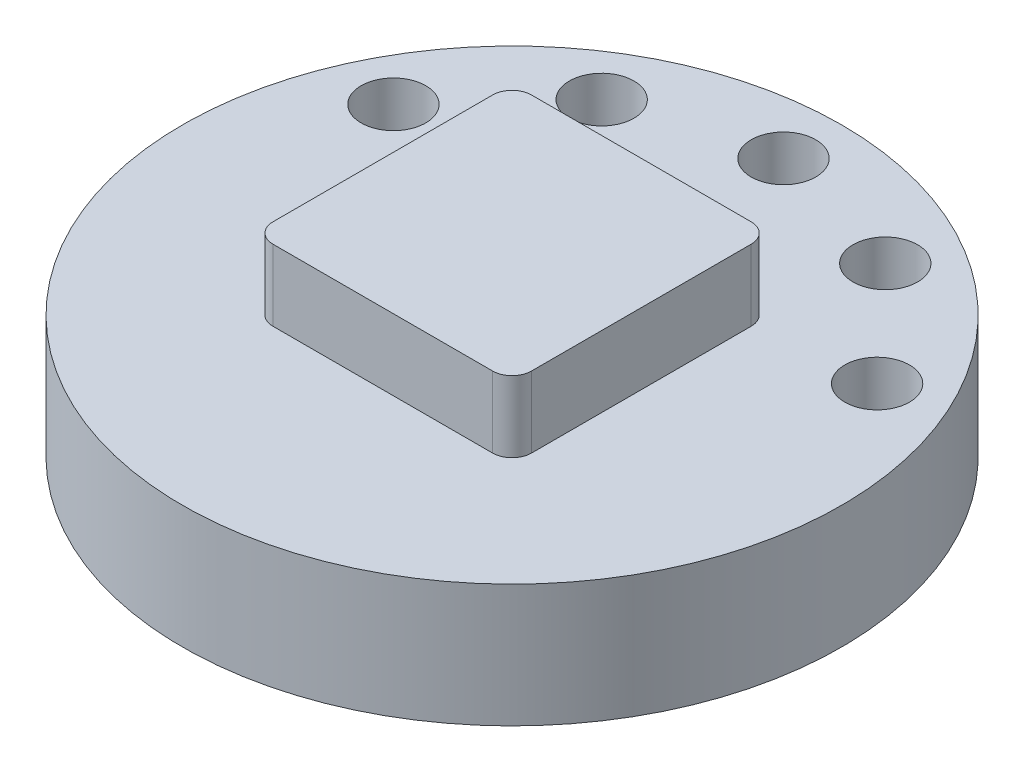
from build123d import *

# Parameters (mm, degrees)
SKIZZE1_R                       = 5.1
SKIZZE1_R_2                     = 0.5
AUFSATZ_LINEAR_AUSTRAGEN1_DEPTH = 1.9
SKIZZE2_W                       = 4
SKIZZE2_H                       = 4
AUFSATZ_LINEAR_AUSTRAGEN2_DEPTH = 1.1
VERRUNDUNG1_R                   = 0.3


with BuildPart() as part:
    # Skizze1 → Aufsatz-Linear austragen1 (new body)
    with BuildSketch(Plane(origin=(0, 0, 0), x_dir=(1, 0, 0), z_dir=(0, 1, 0))):
        Circle(SKIZZE1_R)
        with Locations((0, 4.2)):
            Circle(SKIZZE1_R_2, mode=Mode.SUBTRACT)
        with Locations((2.194493972, 3.58108869)):
            Circle(SKIZZE1_R_2, mode=Mode.SUBTRACT)
        with Locations((3.742227402, 1.906760099)):
            Circle(SKIZZE1_R_2, mode=Mode.SUBTRACT)
        with Locations((-3.742227402, 1.906760099)):
            Circle(SKIZZE1_R_2, mode=Mode.SUBTRACT)
        with Locations((-2.194493972, 3.58108869)):
            Circle(SKIZZE1_R_2, mode=Mode.SUBTRACT)
    extrude(amount=AUFSATZ_LINEAR_AUSTRAGEN1_DEPTH)

    # Skizze2 → Aufsatz-Linear austragen2 (add)
    with BuildSketch(Plane(origin=(0, 1.9, 0), x_dir=(1, 0, 0), z_dir=(0, 1, 0))):
        Rectangle(SKIZZE2_W, SKIZZE2_H)
    extrude(amount=AUFSATZ_LINEAR_AUSTRAGEN2_DEPTH)

    # Verrundung1
    verrundung1_edges = [part.edges().sort_by_distance(p)[0] for p in [
        (-2, 2.45, 2),
        (2, 2.45, 2),
        (2, 2.45, -2),
        (-2, 2.45, -2),
    ]]
    fillet(verrundung1_edges, radius=VERRUNDUNG1_R)


solid = part.part
